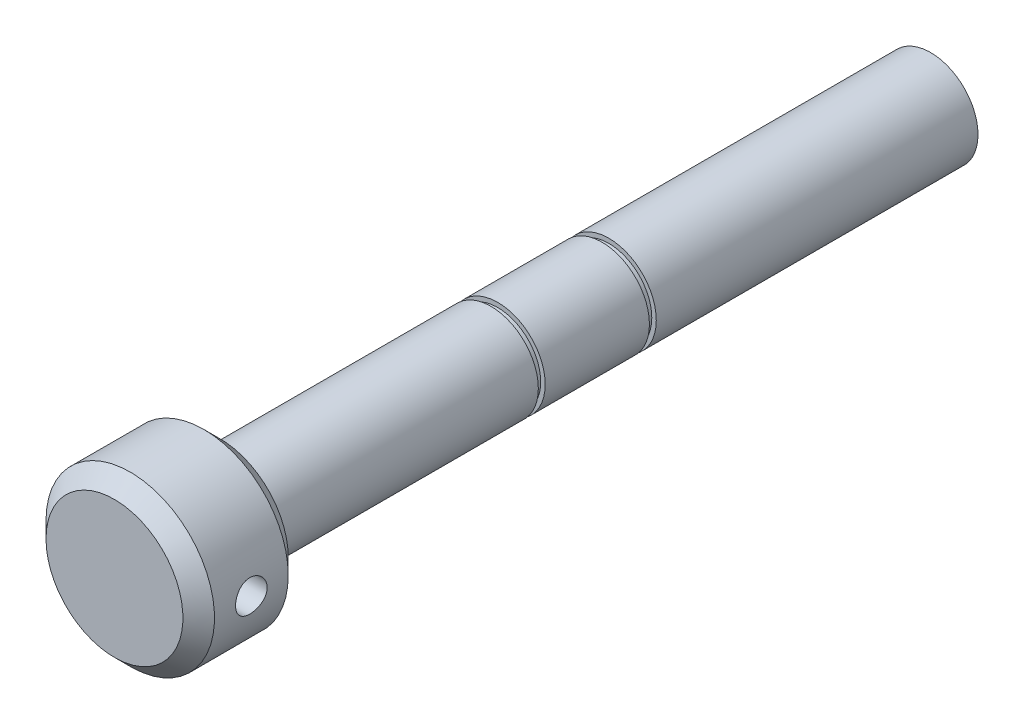
from build123d import *

# Parameters (mm, degrees)
SCHIZZO1_R                    = 16
ESTRUSIONE_ESTRUSIONE1_DEPTH  = 20
SMUSSO1_SIZE                  = 3
TAGLIO_ESTRUSIONE1_DEPTH      = 31.199337741
TAGLIO_ESTRUSIONE1_DEPTH_BACK = 31.199337741
SCHIZZO2_R                    = 3
SCHIZZO3_R                    = 9
ESTRUSIONE_ESTRUSIONE2_DEPTH  = 135
SCHIZZO4_W                    = 1.3
SCHIZZO4_H                    = 0.85


with BuildPart() as part:
    # Schizzo1 → Estrusione-Estrusione1 (new body)
    with BuildSketch(Plane.XY):
        Circle(SCHIZZO1_R)
    extrude(amount=ESTRUSIONE_ESTRUSIONE1_DEPTH)

    # Smusso1
    smusso1_edges = [part.edges().sort_by_distance(p)[0] for p in [
        (-16, 0, 0),
        (-16, 0, 20),
    ]]
    chamfer(smusso1_edges, length=SMUSSO1_SIZE)

    # Schizzo2 → Taglio-Estrusione1 (cut, two sides: drawn at the far end of the back side and taken through both)
    with BuildSketch(Plane(origin=(0, 0, 0), x_dir=(0, 0, -1), z_dir=(1, 0, 0)).offset(-TAGLIO_ESTRUSIONE1_DEPTH_BACK)):
        with Locations((-10, 0)):
            Circle(SCHIZZO2_R)
    extrude(amount=TAGLIO_ESTRUSIONE1_DEPTH + TAGLIO_ESTRUSIONE1_DEPTH_BACK, mode=Mode.SUBTRACT)

    # Schizzo3 → Estrusione-Estrusione2 (add)
    with BuildSketch(Plane.XY):
        Circle(SCHIZZO3_R)
    extrude(amount=-ESTRUSIONE_ESTRUSIONE2_DEPTH)

    # Schizzo4 → Taglia-Rivoluzione1 (revolve, cut)
    with BuildSketch(Plane(origin=(0, 0, 0), x_dir=(0, 0, -1), z_dir=(1, 0, 0)), mode=Mode.PRIVATE) as taglia_rivoluzione1_sk:
        with Locations((52.15, 8.575)):
            Rectangle(SCHIZZO4_W, SCHIZZO4_H)
        with Locations((73.25, 8.575)):
            Rectangle(SCHIZZO4_W, SCHIZZO4_H)
    revolve(taglia_rivoluzione1_sk.sketch.rotate(Axis((0, 0, 0), (0, 0, -1)), 90), axis=Axis((0, 0, 0), (0, 0, -1)), mode=Mode.SUBTRACT)


solid = part.part
